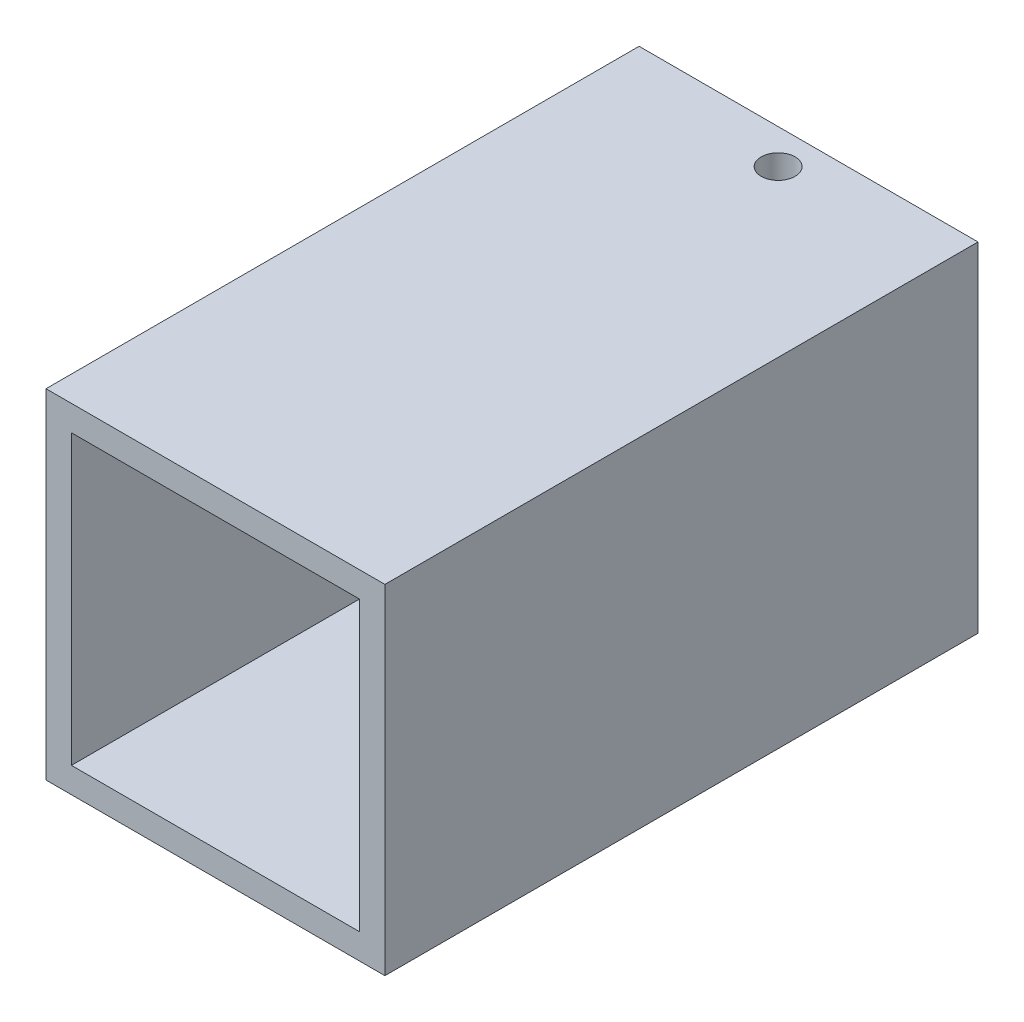
from build123d import *

# Parameters (mm, degrees)
SZKIC1_W                    = 20
SZKIC1_H                    = 20
SZKIC1_W_2                  = 17
SZKIC1_H_2                  = 17
DODANIE_WYCI_GNI_CIE1_DEPTH = 35
SZKIC3_R                    = 1
WYTNIJ_WYCI_GNI_CIE1_DEPTH  = 51.503051903


with BuildPart() as part:
    # Szkic1 → Dodanie-wyciągnięcie1 (new body)
    with BuildSketch(Plane.XY):
        with Locations((-20.422988866, 8.5)):
            Rectangle(SZKIC1_W, SZKIC1_H)
        with Locations((-20.422988866, 8.5)):
            Rectangle(SZKIC1_W_2, SZKIC1_H_2, mode=Mode.SUBTRACT)
    extrude(amount=DODANIE_WYCI_GNI_CIE1_DEPTH)

    # Szkic3 → Wytnij-wyciągnięcie1 (cut, through all)
    with BuildSketch(Plane(origin=(0, 18.5, 0), x_dir=(1, 0, 0), z_dir=(0, 1, 0))):
        with Locations(Location((-20.171616984, -2.046389983, 0), (0, 0, 180))):
            Circle(SZKIC3_R)
    extrude(amount=-WYTNIJ_WYCI_GNI_CIE1_DEPTH, mode=Mode.SUBTRACT)


solid = part.part
